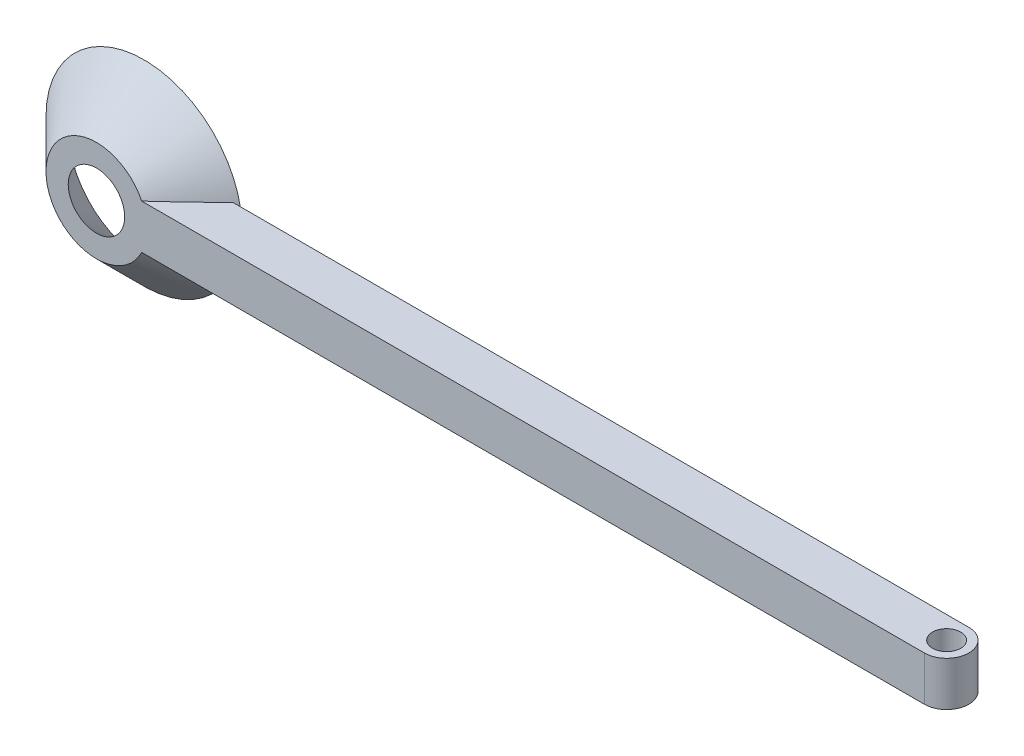
from build123d import *

# Parameters (mm, degrees)
BOSS_EXTRUDE2_DEPTH      = 5
BOSS_EXTRUDE2_DEPTH_BACK = 5
SKETCH1_R                = 3.175


with BuildPart() as part:
    # Sketch1 → Boss-Extrude2 (new, two sides: drawn at the far end of the back side and taken through both)
    with BuildSketch(Plane(origin=(0, 0, 0), x_dir=(1, 0, 0), z_dir=(0, 1, 0)).offset(-BOSS_EXTRUDE2_DEPTH_BACK)):
        with BuildLine():
            Line((-90, -5), (90, -5))
            ThreePointArc((90, -5), (95, 0), (90, 5))
            Line((90, 5), (-90, 5))
            Line((-90, 5), (-90, -5))
        make_face()
        with Locations((90, 0)):
            Circle(SKETCH1_R, mode=Mode.SUBTRACT)
    extrude(amount=BOSS_EXTRUDE2_DEPTH + BOSS_EXTRUDE2_DEPTH_BACK)

    # Sketch8 → Revolve3 (revolve)
    with BuildSketch(Plane(origin=(0, 0, 0), x_dir=(1, 0, 0), z_dir=(0, 1, 0))):
        Polygon((-85, -5), (-74.270246445, 5.729753555), (-79.270246445, 5.729753555), (-90, -5), align=None)
    revolve(axis=Axis((-96.35, 0, -14.166845382), (0, 0, 1)))

    # Sketch10 → Cut-Revolve3 (revolve, cut)
    with BuildSketch(Plane(origin=(0, 0, 0), x_dir=(1, 0, 0), z_dir=(0, 1, 0))):
        Polygon((-96.35, 5.729753555), (-79.270246445, 5.729753555), (-90, -5), (-96.35, -5), align=None)
    revolve(axis=Axis((-96.35, 0, -5.729753555), (0, 0, 1)), mode=Mode.SUBTRACT)


solid = part.part
